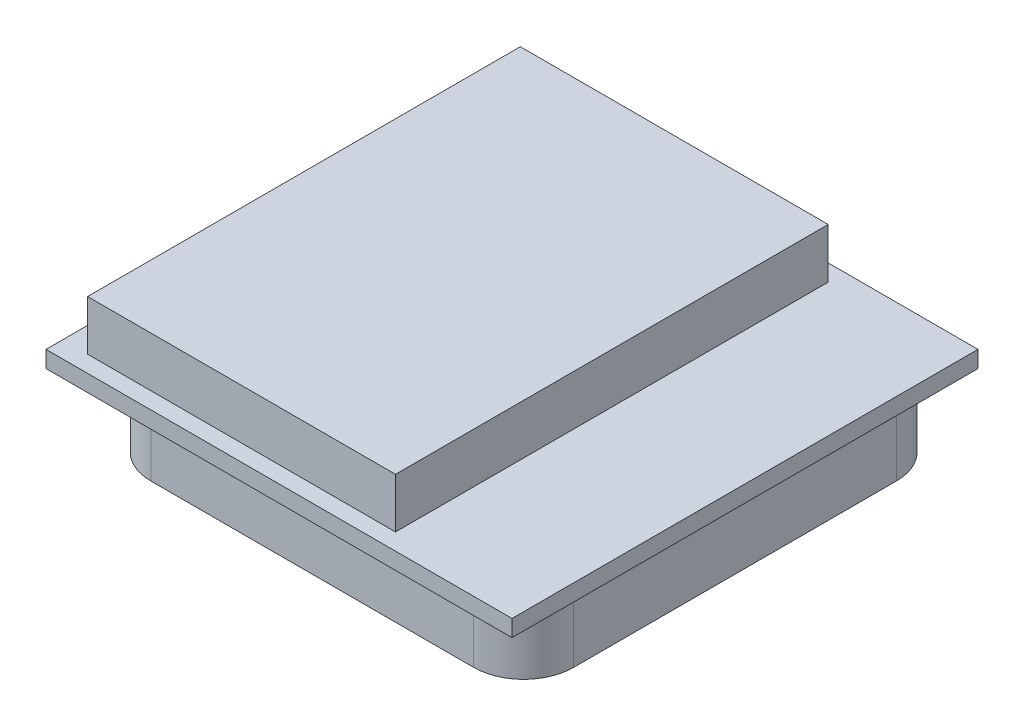
from build123d import *

# Parameters (mm, degrees)
SKETCH_1_W      = 28
SKETCH_1_H      = 28
EXTRUDE_1_DEPTH = 1
SKETCH_1_3_W    = 25.4
SKETCH_1_3_H    = 25.4
EXTRUDE_2_DEPTH = 4
SKETCH_1_4_W    = 18.5
SKETCH_1_4_H    = 26
EXTRUDE_3_DEPTH = 4
FILLET_1_R      = 3


with BuildPart() as part:
    # Эскиз1 → Бобышка-Вытянуть1 (new body)
    with BuildSketch(Plane(origin=(0, 0, 0), x_dir=(1, 0, 0), z_dir=(0, 1, 0))):
        Rectangle(SKETCH_1_W, SKETCH_1_H)
    extrude(amount=EXTRUDE_1_DEPTH)

    # Эскиз1<3> → Бобышка-Вытянуть2 (add)
    with BuildSketch(Plane(origin=(0, 0, 0), x_dir=(1, 0, 0), z_dir=(0, 1, 0))):
        with Locations((0.7, 0)):
            Rectangle(SKETCH_1_3_W, SKETCH_1_3_H)
    extrude(amount=-EXTRUDE_2_DEPTH)

    # Эскиз1<4> → Бобышка-Вытянуть3 (add)
    with BuildSketch(Plane(origin=(0, 0, 0), x_dir=(1, 0, 0), z_dir=(0, 1, 0))):
        with Locations((-3.25, 0)):
            Rectangle(SKETCH_1_4_W, SKETCH_1_4_H)
    extrude(amount=EXTRUDE_3_DEPTH)

    # Скругление1
    fillet_1_edges = [part.edges().sort_by_distance(p)[0] for p in [
        (-12, -2, 12.7),
        (13.4, -2, 12.7),
        (13.4, -2, -12.7),
        (-12, -2, -12.7),
    ]]
    fillet(fillet_1_edges, radius=FILLET_1_R)


solid = part.part
